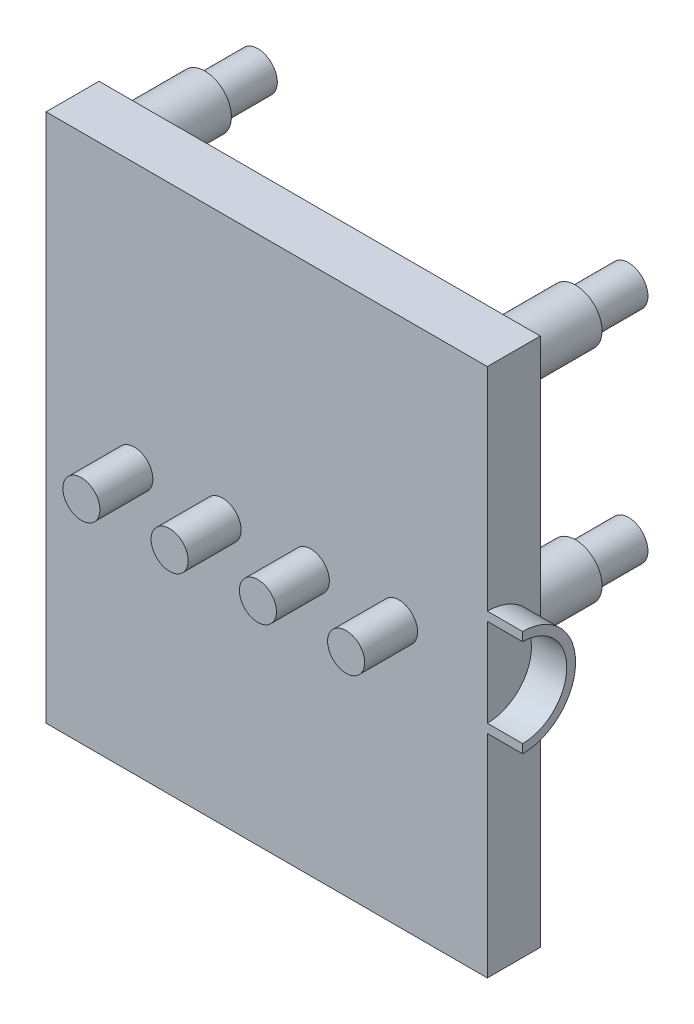
from build123d import *

# Parameters (mm, degrees)
CROQUIS1_W              = 25
CROQUIS1_H              = 30
SALIENTE_EXTRUIR1_DEPTH = 3
CROQUIS2_R              = 1.05
SALIENTE_EXTRUIR2_DEPTH = 3
SALIENTE_EXTRUIR3_DEPTH = 2
CROQUIS4_R              = 1.5
SALIENTE_EXTRUIR4_DEPTH = 4
CROQUIS5_R              = 1.1
SALIENTE_EXTRUIR5_DEPTH = 3


with BuildPart() as part:
    # Croquis1 → Saliente-Extruir1 (new body)
    with BuildSketch(Plane.XY):
        Rectangle(CROQUIS1_W, CROQUIS1_H)
    extrude(amount=SALIENTE_EXTRUIR1_DEPTH)

    # Croquis2 → Saliente-Extruir2 (add)
    with BuildSketch(Plane.XY.offset(3)):
        with Locations(Location((-7.5, 0, 0), (0, 0, 180))):
            Circle(CROQUIS2_R)
        with Locations(Location((-2.5, 0, 0), (0, 0, 180))):
            Circle(CROQUIS2_R)
        with Locations(Location((2.5, 0, 0), (0, 0, 180))):
            Circle(CROQUIS2_R)
        with Locations(Location((7.5, 0, 0), (0, 0, 180))):
            Circle(CROQUIS2_R)
    extrude(amount=SALIENTE_EXTRUIR2_DEPTH)

    # Croquis3 → Saliente-Extruir3 (add)
    with BuildSketch(Plane(origin=(12.5, 0, 0), x_dir=(0, 0, -1), z_dir=(1, 0, 0))):
        with BuildLine():
            Line((-3, 3), (-3, 2.5))
            ThreePointArc((-3, 2.5), (-0.5, 0), (-3, -2.5))
            Line((-3, -2.5), (-3, -3))
            ThreePointArc((-3, -3), (0, 0), (-3, 3))
        make_face()
    extrude(amount=SALIENTE_EXTRUIR3_DEPTH)

    # Croquis4 → Saliente-Extruir4 (add)
    with BuildSketch(Plane(origin=(0, 0, 0), x_dir=(-1, 0, 0), z_dir=(0, 0, -1))):
        with Locations((10.5, 13)):
            Circle(CROQUIS4_R)
        with Locations((-10.5, 13)):
            Circle(CROQUIS4_R)
        with Locations((-10.5, 0.5)):
            Circle(CROQUIS4_R)
        with Locations((10.5, 0.5)):
            Circle(CROQUIS4_R)
    extrude(amount=SALIENTE_EXTRUIR4_DEPTH)

    # Croquis5 → Saliente-Extruir5 (add)
    with BuildSketch(Plane(origin=(0, 0, -4), x_dir=(-1, 0, 0), z_dir=(0, 0, -1))):
        with Locations((10.5, 13)):
            Circle(CROQUIS5_R)
        with Locations((-10.5, 13)):
            Circle(CROQUIS5_R)
        with Locations((-10.5, 0.5)):
            Circle(CROQUIS5_R)
        with Locations((10.5, 0.5)):
            Circle(CROQUIS5_R)
    extrude(amount=SALIENTE_EXTRUIR5_DEPTH)


solid = part.part
